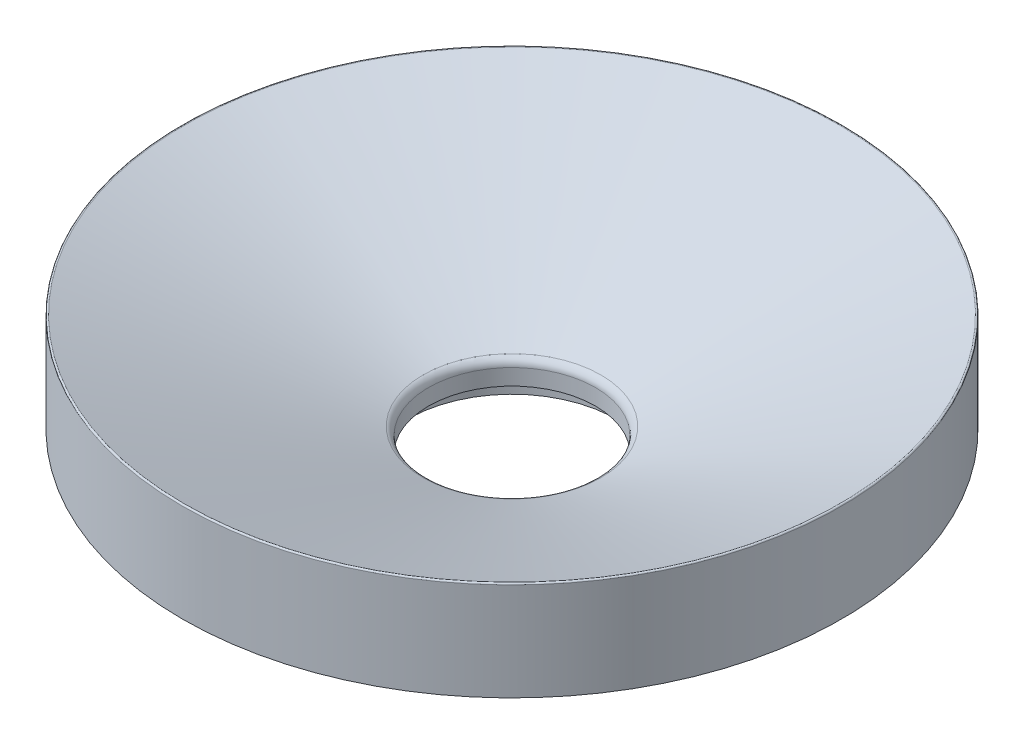
from build123d import *

# Parameters (mm, degrees)
SKETCH1_R           = 17.653
SKETCH1_R_2         = 15.113
BOSS_EXTRUDE1_DEPTH = 3.175
SKETCH2_R           = 17.653
SKETCH2_R_2         = 12.065
BOSS_EXTRUDE2_DEPTH = 3.175
SKETCH7_R           = 47.625
BOSS_EXTRUDE3_DEPTH = 14.41963842
SKETCH3_R           = 12.065
CHAMFER1_SIZE       = 2.54
CHAMFER1_SIZE2      = 9.479409051
FILLET6_R           = 1.27
FILLET7_R           = 0.1905


with BuildPart() as part:
    # Sketch1 → Boss-Extrude1 (new body)
    with BuildSketch(Plane(origin=(0, 0, 0), x_dir=(1, 0, 0), z_dir=(0, 1, 0))):
        Circle(SKETCH1_R)
        Circle(SKETCH1_R_2, mode=Mode.SUBTRACT)
    extrude(amount=BOSS_EXTRUDE1_DEPTH)

    # Sketch2 → Boss-Extrude2 (add)
    with BuildSketch(Plane(origin=(0, 3.175, 0), x_dir=(1, 0, 0), z_dir=(0, 1, 0))):
        Circle(SKETCH2_R)
        Circle(SKETCH2_R_2, mode=Mode.SUBTRACT)
    extrude(amount=BOSS_EXTRUDE2_DEPTH)

    # Sketch7 → Boss-Extrude3 (add)
    with BuildSketch(Plane(origin=(0, 6.35, 0), x_dir=(1, 0, 0), z_dir=(0, 1, 0))):
        Circle(SKETCH7_R)
    extrude(amount=BOSS_EXTRUDE3_DEPTH)

    # Sketch3 → section 0 of cut_loft1
    with BuildSketch(Plane(origin=(0, 6.35, 0), x_dir=(1, 0, 0), z_dir=(0, 1, 0)), mode=Mode.PRIVATE) as cut_loft1_s0:
        Circle(SKETCH3_R)
    # loft up to a face of the part (cut_loft1)
    loft([cut_loft1_s0.sketch, part.faces().sort_by_distance((0, 20.76963842, 0))[0]], mode=Mode.SUBTRACT)

    # Chamfer1
    chamfer1_edges = [part.edges().sort_by_distance(p)[0] for p in [
        (-17.653, 6.35, 0),
    ]]
    chamfer1_side = [part.faces().sort_by_distance(p)[0] for p in [
        (-17.653, 3.175, 0),
    ]]
    chamfer(chamfer1_edges, length=CHAMFER1_SIZE, length2=CHAMFER1_SIZE2, reference=chamfer1_side[0])

    # Fillet6
    fillet6_edges = [part.edges().sort_by_distance(p)[0] for p in [
        (-12.065, 6.35, 0),
    ]]
    fillet(fillet6_edges, radius=FILLET6_R)

    # Fillet7
    fillet7_edges = [part.edges().sort_by_distance(p)[0] for p in [
        (-47.625, 20.76963842, 0),
    ]]
    fillet(fillet7_edges, radius=FILLET7_R)


solid = part.part
